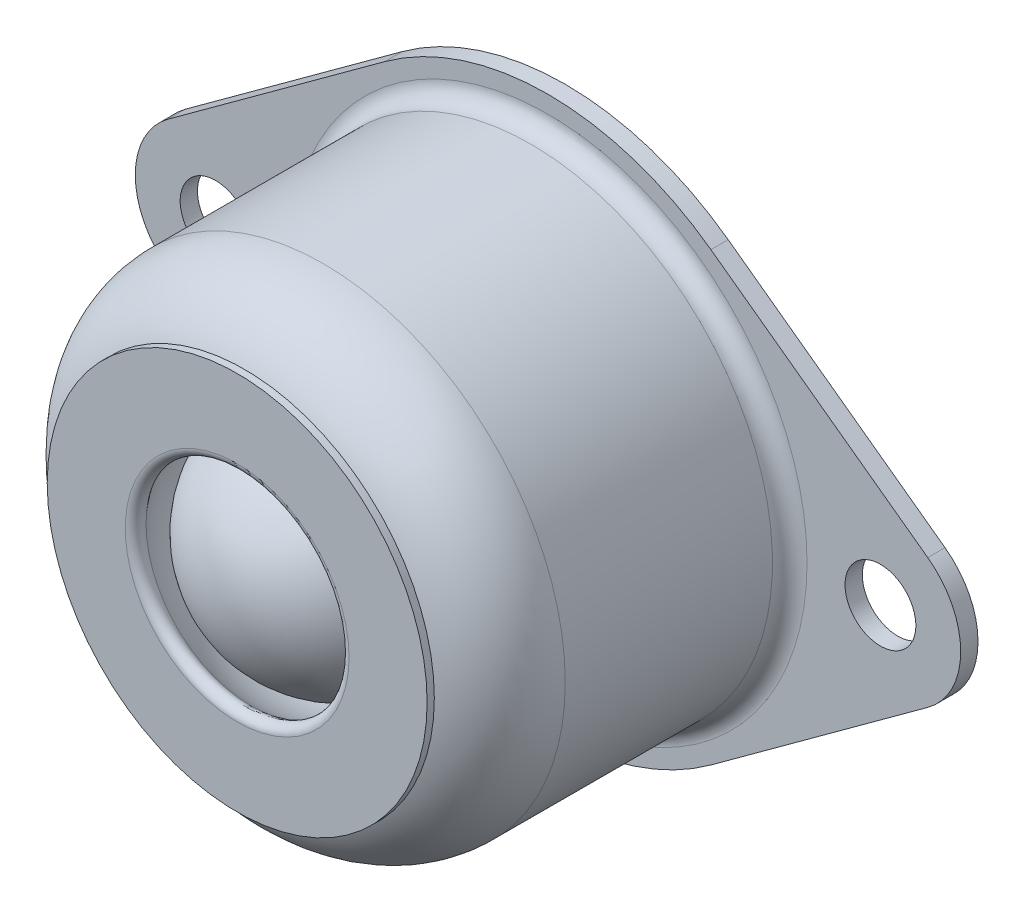
from build123d import *

# Parameters (mm, degrees)
SKETCH1_R           = 14
SKETCH1_R_2         = 8
BOSS_EXTRUDE1_DEPTH = 19
SKETCH2_R           = 2.05
SKETCH2_R_2         = 12.5
BOSS_EXTRUDE2_DEPTH = 1
FILLET1_R           = 1
FILLET2_R           = 5
SKETCH8_R           = 12.5
CUT_EXTRUDE2_DEPTH  = 8.8
FILLET3_R           = 0.5
FILLET4_R           = 1
FILLET5_R           = 2


with BuildPart() as part:
    # Sketch1 → Boss-Extrude1 (new body)
    with BuildSketch(Plane.XY):
        Circle(SKETCH1_R)
        Circle(SKETCH1_R_2, mode=Mode.SUBTRACT)
    extrude(amount=BOSS_EXTRUDE1_DEPTH)

    # Sketch2 → Boss-Extrude2 (add)
    with BuildSketch(Plane(origin=(0, 0, 0), x_dir=(-1, 0, 0), z_dir=(0, 0, -1))):
        with BuildLine():
            Line((21.991688312, 3.755748288), (9.433766234, 12.923004861))
            ThreePointArc((9.433766234, 12.923004861), (0, 16), (-9.433766234, 12.923004861))
            Line((-9.433766234, 12.923004861), (-21.991688312, 3.755748288))
            ThreePointArc((-21.991688312, 3.755748288), (-23.9, 0), (-21.991688312, -3.755748288))
            Line((-21.991688312, -3.755748288), (-9.433766234, -12.923004861))
            ThreePointArc((-9.433766234, -12.923004861), (0, -16), (9.433766234, -12.923004861))
            Line((9.433766234, -12.923004861), (21.991688312, -3.755748288))
            ThreePointArc((21.991688312, -3.755748288), (23.9, 0), (21.991688312, 3.755748288))
        make_face()
        with Locations((-19.25, 0)):
            Circle(SKETCH2_R, mode=Mode.SUBTRACT)
        Circle(SKETCH2_R_2, mode=Mode.SUBTRACT)
        with Locations(Location((19.25, 0, 0), (0, 0, 180))):
            Circle(SKETCH2_R, mode=Mode.SUBTRACT)
    extrude(amount=-BOSS_EXTRUDE2_DEPTH)

    # Fillet1
    fillet1_edges = [part.edges().sort_by_distance(p)[0] for p in [
        (-14, 0, 1),
    ]]
    fillet(fillet1_edges, radius=FILLET1_R)

    # Fillet2
    fillet2_edges = [part.edges().sort_by_distance(p)[0] for p in [
        (-14, 0, 19),
    ]]
    fillet(fillet2_edges, radius=FILLET2_R)

    # Sketch8 → Cut-Extrude2 (cut)
    with BuildSketch(Plane(origin=(0, 0, 0), x_dir=(-1, 0, 0), z_dir=(0, 0, -1))):
        Circle(SKETCH8_R)
    extrude(amount=-CUT_EXTRUDE2_DEPTH, mode=Mode.SUBTRACT)

    # Sketch7 → Revolve2 (revolve)
    with BuildSketch(Plane(origin=(0, 0, 0), x_dir=(1, 0, 0), z_dir=(0, 1, 0))):
        with BuildLine():
            Line((5.291502622, -19), (11, -19))
            Line((11, -19), (11, -13))
            ThreePointArc((11, -13), (7.778174593, -5.221825407), (0, -2))
            Line((0, -2), (0, -5))
            ThreePointArc((0, -5), (7.483314774, -10.171572875), (5.291502622, -19))
        make_face()
    revolve(axis=Axis((0, 0, 2), (0, 0, 1)))

    # Fillet3
    fillet3_edges = [part.edges().sort_by_distance(p)[0] for p in [
        (-5.291502622, 0, 19),
    ]]
    fillet(fillet3_edges, radius=FILLET3_R)

    # Fillet4
    fillet4_edges = [part.edges().sort_by_distance(p)[0] for p in [
        (12.5, 0, 8.8),
        (-10.166612022, 0, 8.8),
    ]]
    fillet(fillet4_edges, radius=FILLET4_R)

    # Fillet5
    fillet5_edges = [part.edges().sort_by_distance(p)[0] for p in [
        (12.5, 0, 0),
    ]]
    fillet(fillet5_edges, radius=FILLET5_R)


with BuildPart() as body_2:
    # Sketch6 → Revolve1 (revolve)
    with BuildSketch(Plane(origin=(0, 0, 0), x_dir=(1, 0, 0), z_dir=(0, 1, 0))):
        with BuildLine():
            Line((0, -6), (0, -20))
            ThreePointArc((0, -20), (7, -13), (0, -6))
        make_face()
    revolve(axis=Axis((0, 0, 6), (0, 0, 1)))


solid = Compound([part.part, body_2.part])
